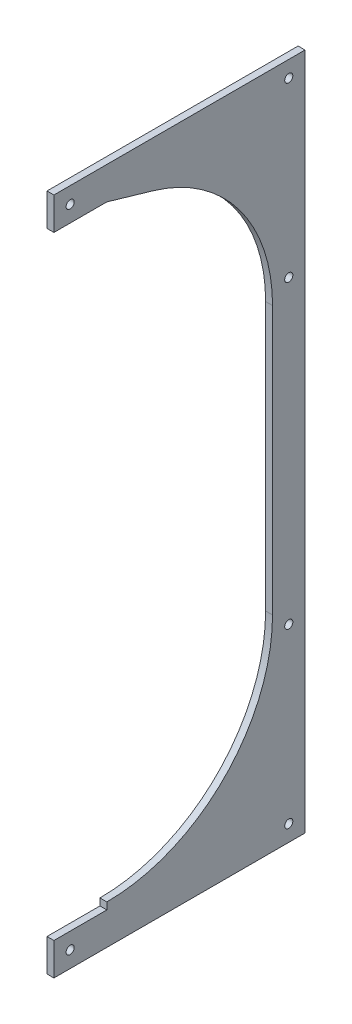
from build123d import *

# Parameters (mm, degrees)
SKETCH1_R           = 3.175
BOSS_EXTRUDE3_DEPTH = 5.4102
CUT_EXTRUDE1_DEPTH  = 5.4102


with BuildPart() as part:
    # Sketch1 → Boss-Extrude3 (new body)
    with BuildSketch(Plane(origin=(0, 0, 0), x_dir=(0, 0, -1), z_dir=(1, 0, 0))):
        with BuildLine():
            ThreePointArc((129.54, 0), (124.431830765, -36.01848265), (109.510185389, -69.196321406))
            ThreePointArc((109.510185389, -69.196321406), (62.517678, -113.455504659), (0, -129.54))
            Line((0, -129.54), (0, -134.9502))
            Line((0, -134.9502), (-41.402, -134.9502))
            Line((-41.402, -134.9502), (-41.402, -160.3502))
            Line((-41.402, -160.3502), (154.94, -160.3502))
            Line((154.94, -160.3502), (154.94, 369.88496))
            Line((154.94, 369.88496), (-41.402, 369.88496))
            Line((-41.402, 369.88496), (-41.402, 344.48496))
            Line((-41.402, 344.48496), (0, 344.48496))
            Line((0, 344.48496), (0, 339.07476))
            ThreePointArc((0, 339.07476), (62.517678, 322.990264659), (109.510185389, 278.731081406))
            ThreePointArc((109.510185389, 278.731081406), (124.431830765, 245.55324265), (129.54, 209.53476))
            Line((129.54, 209.53476), (129.54, 0))
        make_face()
        with Locations((-28.702, -147.6502)):
            Circle(SKETCH1_R, mode=Mode.SUBTRACT)
        with Locations((142.24, -147.6502)):
            Circle(SKETCH1_R, mode=Mode.SUBTRACT)
        with Locations((142.24, -12.7)):
            Circle(SKETCH1_R, mode=Mode.SUBTRACT)
        with Locations((-28.702, 357.18496)):
            Circle(SKETCH1_R, mode=Mode.SUBTRACT)
        with Locations((142.24, 222.23476)):
            Circle(SKETCH1_R, mode=Mode.SUBTRACT)
        with Locations((142.24, 357.18496)):
            Circle(SKETCH1_R, mode=Mode.SUBTRACT)
    extrude(amount=BOSS_EXTRUDE3_DEPTH)

    # Sketch2 → Cut-Extrude1 (cut)
    with BuildSketch(Plane(origin=(5.4102, 0, 0), x_dir=(0, 0, -1), z_dir=(1, 0, 0))):
        Polygon((0, 344.48496), (36.311280568, 333.881462825), (0, 339.07476), align=None)
    extrude(amount=-CUT_EXTRUDE1_DEPTH, mode=Mode.SUBTRACT)


solid = part.part
